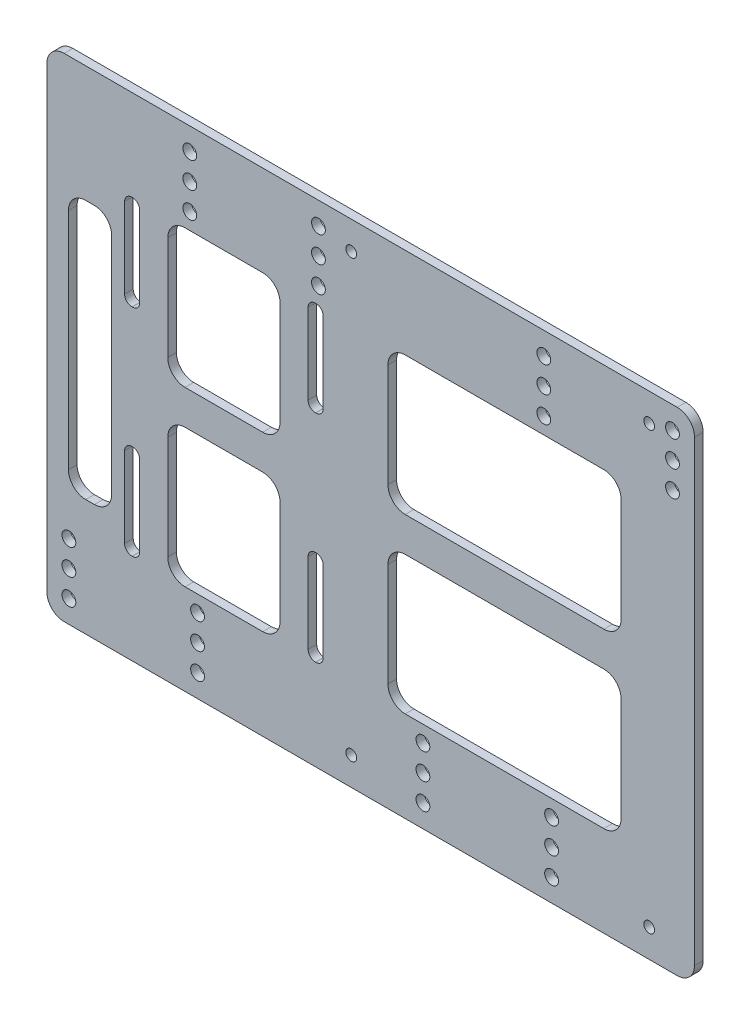
from build123d import *

# Parameters (mm, degrees)
BOSS_EXTRUDE1_DEPTH     = 2
CUT_EXTRUDE6_DEPTH      = 95.223139409
CUT_EXTRUDE6_DEPTH_BACK = 95.223139409
SKETCH2_R               = 1.6
SKETCH2_R_2             = 1.25


with BuildPart() as part:
    # Sketch1 → Boss-Extrude1 (new body)
    with BuildSketch(Plane(origin=(0, 0, 0), x_dir=(0, 1, 0), z_dir=(0, 0, 1))):
        with BuildLine():
            Line((-53, -75), (53, -75))
            ThreePointArc((53, -75), (55.828427125, -73.828427125), (57, -71))
            Line((57, -71), (57, 71))
            ThreePointArc((57, 71), (55.828427125, 73.828427125), (53, 75))
            Line((53, 75), (-53, 75))
            ThreePointArc((-53, 75), (-55.828427125, 73.828427125), (-57, 71))
            Line((-57, 71), (-57, -71))
            ThreePointArc((-57, -71), (-55.828427125, -73.828427125), (-53, -75))
        make_face()
    extrude(amount=BOSS_EXTRUDE1_DEPTH)

    # Sketch2 → Cut-Extrude6 (cut, two sides: drawn at the far end of the back side and taken through both)
    with BuildSketch(Plane(origin=(0, 0, 0), x_dir=(0, 1, 0), z_dir=(0, 0, 1)).offset(-CUT_EXTRUDE6_DEPTH_BACK)):
        with Locations(Location((-51.8, 40.1, 0), (0, 0, 270))):
            Circle(SKETCH2_R)
        with Locations(Location((-51.8, 69.9, 0), (0, 0, 270))):
            Circle(SKETCH2_R)
        with Locations(Location((-45.8, 40.1, 0), (0, 0, 270))):
            Circle(SKETCH2_R)
        with Locations(Location((-45.8, 69.9, 0), (0, 0, 270))):
            Circle(SKETCH2_R)
        with Locations(Location((-39.8, 40.1, 0), (0, 0, 270))):
            Circle(SKETCH2_R)
        with Locations(Location((-39.8, 69.9, 0), (0, 0, 270))):
            Circle(SKETCH2_R)
        with Locations(Location((-51.8, -41.9, 0), (0, 0, 270))):
            Circle(SKETCH2_R)
        with Locations(Location((-51.8, -12.1, 0), (0, 0, 270))):
            Circle(SKETCH2_R)
        with Locations(Location((-45.8, -41.9, 0), (0, 0, 270))):
            Circle(SKETCH2_R)
        with Locations(Location((-45.8, -12.1, 0), (0, 0, 270))):
            Circle(SKETCH2_R)
        with Locations(Location((-39.8, -41.9, 0), (0, 0, 270))):
            Circle(SKETCH2_R)
        with Locations(Location((-39.8, -12.1, 0), (0, 0, 270))):
            Circle(SKETCH2_R)
        with Locations(Location((51.8, 12.1, 0), (0, 0, 270))):
            Circle(SKETCH2_R)
        with Locations(Location((51.8, 41.9, 0), (0, 0, 270))):
            Circle(SKETCH2_R)
        with Locations(Location((45.8, 12.1, 0), (0, 0, 270))):
            Circle(SKETCH2_R)
        with Locations(Location((45.8, 41.9, 0), (0, 0, 270))):
            Circle(SKETCH2_R)
        with Locations(Location((39.8, 12.1, 0), (0, 0, 270))):
            Circle(SKETCH2_R)
        with Locations(Location((39.8, 41.9, 0), (0, 0, 270))):
            Circle(SKETCH2_R)
        with Locations(Location((51.8, -69.9, 0), (0, 0, 270))):
            Circle(SKETCH2_R)
        with Locations(Location((51.8, -40.1, 0), (0, 0, 270))):
            Circle(SKETCH2_R)
        with Locations(Location((45.8, -69.9, 0), (0, 0, 270))):
            Circle(SKETCH2_R)
        with Locations(Location((45.8, -40.1, 0), (0, 0, 270))):
            Circle(SKETCH2_R)
        with Locations(Location((39.8, -69.9, 0), (0, 0, 270))):
            Circle(SKETCH2_R)
        with Locations(Location((39.8, -40.1, 0), (0, 0, 270))):
            Circle(SKETCH2_R)
        with Locations(Location((-50.5, -64.5, 0), (0, 0, 270))):
            Circle(SKETCH2_R_2)
        with Locations(Location((-50.5, 4.5, 0), (0, 0, 270))):
            Circle(SKETCH2_R_2)
        with Locations(Location((50.5, -64.5, 0), (0, 0, 270))):
            Circle(SKETCH2_R_2)
        with Locations(Location((50.5, 4.5, 0), (0, 0, 270))):
            Circle(SKETCH2_R_2)
        with BuildLine():
            Line((-34.3, 11), (-15.7, 11))
            ThreePointArc((-15.7, 11), (-14.497918472, 11.497918472), (-14, 12.7))
            Line((-14, 12.7), (-14, 12.8))
            ThreePointArc((-14, 12.8), (-14.497918472, 14.002081528), (-15.7, 14.5))
            Line((-15.7, 14.5), (-34.3, 14.5))
            ThreePointArc((-34.3, 14.5), (-35.502081528, 14.002081528), (-36, 12.8))
            Line((-36, 12.8), (-36, 12.7))
            ThreePointArc((-36, 12.7), (-35.502081528, 11.497918472), (-34.3, 11))
        make_face()
        with BuildLine():
            Line((-34.3, 53.5), (-15.7, 53.5))
            ThreePointArc((-15.7, 53.5), (-14.497918472, 53.997918472), (-14, 55.2))
            Line((-14, 55.2), (-14, 55.3))
            ThreePointArc((-14, 55.3), (-14.497918472, 56.502081528), (-15.7, 57))
            Line((-15.7, 57), (-34.3, 57))
            ThreePointArc((-34.3, 57), (-35.502081528, 56.502081528), (-36, 55.3))
            Line((-36, 55.3), (-36, 55.2))
            ThreePointArc((-36, 55.2), (-35.502081528, 53.997918472), (-34.3, 53.5))
        make_face()
        with BuildLine():
            Line((15.7, 11), (34.3, 11))
            ThreePointArc((34.3, 11), (35.502081528, 11.497918472), (36, 12.7))
            Line((36, 12.7), (36, 12.8))
            ThreePointArc((36, 12.8), (35.502081528, 14.002081528), (34.3, 14.5))
            Line((34.3, 14.5), (15.7, 14.5))
            ThreePointArc((15.7, 14.5), (14.497918472, 14.002081528), (14, 12.8))
            Line((14, 12.8), (14, 12.7))
            ThreePointArc((14, 12.7), (14.497918472, 11.497918472), (15.7, 11))
        make_face()
        with BuildLine():
            Line((15.7, 53.5), (34.3, 53.5))
            ThreePointArc((34.3, 53.5), (35.502081528, 53.997918472), (36, 55.2))
            Line((36, 55.2), (36, 55.3))
            ThreePointArc((36, 55.3), (35.502081528, 56.502081528), (34.3, 57))
            Line((34.3, 57), (15.7, 57))
            ThreePointArc((15.7, 57), (14.497918472, 56.502081528), (14, 55.3))
            Line((14, 55.3), (14, 55.2))
            ThreePointArc((14, 55.2), (14.497918472, 53.997918472), (15.7, 53.5))
        make_face()
        with BuildLine():
            Line((-32, -58), (-8, -58))
            ThreePointArc((-8, -58), (-5.171572875, -56.828427125), (-4, -54))
            Line((-4, -54), (-4, -8))
            ThreePointArc((-4, -8), (-5.171572875, -5.171572875), (-8, -4))
            Line((-8, -4), (-32, -4))
            ThreePointArc((-32, -4), (-34.828427125, -5.171572875), (-36, -8))
            Line((-36, -8), (-36, -54))
            ThreePointArc((-36, -54), (-34.828427125, -56.828427125), (-32, -58))
        make_face()
        with BuildLine():
            Line((-32, 21), (-8, 21))
            ThreePointArc((-8, 21), (-5.171572875, 22.171572875), (-4, 25))
            Line((-4, 25), (-4, 43))
            ThreePointArc((-4, 43), (-5.171572875, 45.828427125), (-8, 47))
            Line((-8, 47), (-32, 47))
            ThreePointArc((-32, 47), (-34.828427125, 45.828427125), (-36, 43))
            Line((-36, 43), (-36, 25))
            ThreePointArc((-36, 25), (-34.828427125, 22.171572875), (-32, 21))
        make_face()
        with BuildLine():
            Line((8, -58), (32, -58))
            ThreePointArc((32, -58), (34.828427125, -56.828427125), (36, -54))
            Line((36, -54), (36, -8))
            ThreePointArc((36, -8), (34.828427125, -5.171572875), (32, -4))
            Line((32, -4), (8, -4))
            ThreePointArc((8, -4), (5.171572875, -5.171572875), (4, -8))
            Line((4, -8), (4, -54))
            ThreePointArc((4, -54), (5.171572875, -56.828427125), (8, -58))
        make_face()
        with BuildLine():
            Line((8, 21), (32, 21))
            ThreePointArc((32, 21), (34.828427125, 22.171572875), (36, 25))
            Line((36, 25), (36, 43))
            ThreePointArc((36, 43), (34.828427125, 45.828427125), (32, 47))
            Line((32, 47), (8, 47))
            ThreePointArc((8, 47), (5.171572875, 45.828427125), (4, 43))
            Line((4, 43), (4, 25))
            ThreePointArc((4, 25), (5.171572875, 22.171572875), (8, 21))
        make_face()
        with BuildLine():
            Line((-26, 60), (26, 60))
            ThreePointArc((26, 60), (28.828427125, 61.171572875), (30, 64))
            Line((30, 64), (30, 66))
            ThreePointArc((30, 66), (28.828427125, 68.828427125), (26, 70))
            Line((26, 70), (-26, 70))
            ThreePointArc((-26, 70), (-28.828427125, 68.828427125), (-30, 66))
            Line((-30, 66), (-30, 64))
            ThreePointArc((-30, 64), (-28.828427125, 61.171572875), (-26, 60))
        make_face()
    extrude(amount=CUT_EXTRUDE6_DEPTH + CUT_EXTRUDE6_DEPTH_BACK, mode=Mode.SUBTRACT)


solid = part.part
